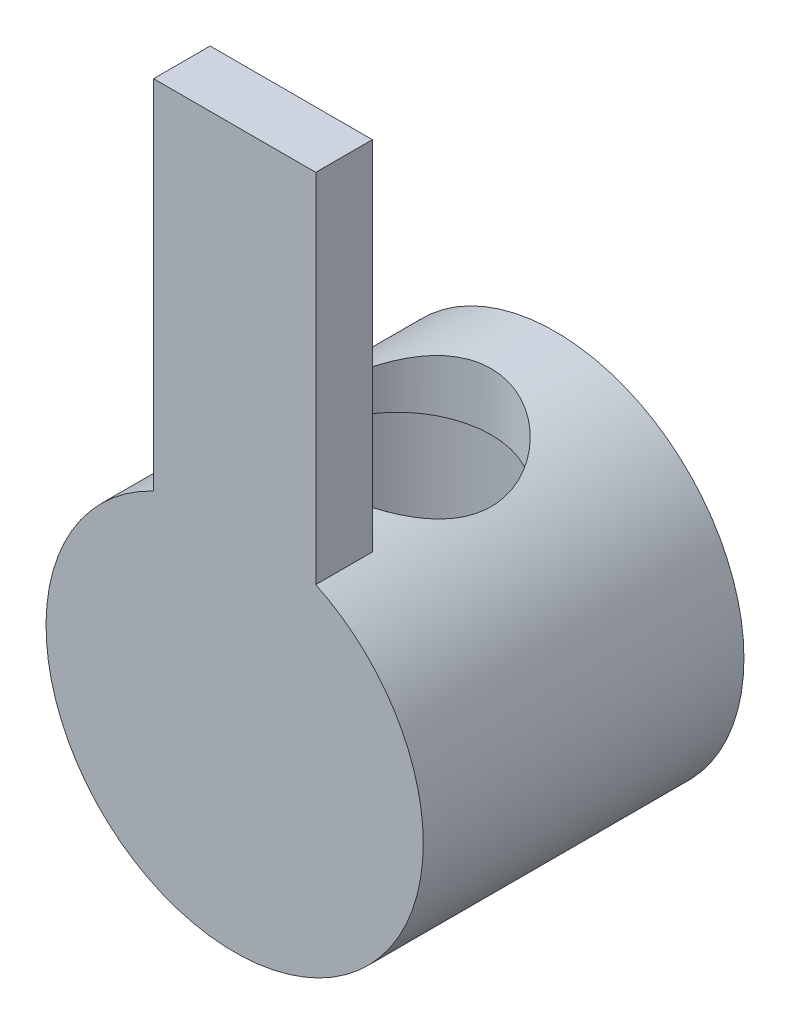
from build123d import *

# Parameters (mm, degrees)
SKETCH_1_W               = 4.3
SKETCH_1_H               = 18
EXTRUDE_1_DEPTH          = 1.5
SKETCH_4_W               = 4.3
SKETCH_4_H               = 1.948435562
CUT_EXTRUDE_1_DEPTH      = 10.374033283
SKETCH_2_R               = 5
EXTRUDE_2_DEPTH          = 8.5
SKETCH_5_R               = 2.5
CUT_EXTRUDE_2_DEPTH      = 21.838435642
CUT_EXTRUDE_3_DEPTH      = 2.5
CUT_EXTRUDE_3_DEPTH_BACK = 10
SKETCH_6_R               = 3.5


with BuildPart() as part:
    # 草图1 → 凸台-拉伸1 (new body)
    with BuildSketch(Plane.XY):
        Rectangle(SKETCH_1_W, SKETCH_1_H)
    extrude(amount=EXTRUDE_1_DEPTH)

    # 草图4 → 切除-拉伸1 (cut, through all)
    with BuildSketch(Plane(origin=(0, 0, 0), x_dir=(-1, 0, 0), z_dir=(0, 0, -1))):
        with Locations((0, -8.025782219)):
            Rectangle(SKETCH_4_W, SKETCH_4_H)
    extrude(amount=-CUT_EXTRUDE_1_DEPTH, mode=Mode.SUBTRACT)

    # 草图2 → 凸台-拉伸2 (add)
    with BuildSketch(Plane.XY.offset(1.5)):
        with Locations((0, -4.98)):
            Circle(SKETCH_2_R)
    extrude(amount=-EXTRUDE_2_DEPTH)

    # 草图5 → 切除-拉伸2 (cut, through all)
    with BuildSketch(Plane(origin=(0, 9, 0), x_dir=(1, 0, 0), z_dir=(0, 1, 0))):
        with Locations(Location((0, 2.8, 0), (0, 0, 270))):
            Circle(SKETCH_5_R)
    extrude(amount=-CUT_EXTRUDE_2_DEPTH, mode=Mode.SUBTRACT)

    # 草图6 → 切除-拉伸3 (cut, two sides: drawn at the far end of the back side and taken through both)
    with BuildSketch(Plane(origin=(0, -4, 0), x_dir=(1, 0, 0), z_dir=(0, 1, 0)).offset(-CUT_EXTRUDE_3_DEPTH_BACK)):
        with Locations(Location((0, 2.8, 0), (0, 0, 90))):
            Circle(SKETCH_6_R)
    extrude(amount=CUT_EXTRUDE_3_DEPTH + CUT_EXTRUDE_3_DEPTH_BACK, mode=Mode.SUBTRACT)


solid = part.part
